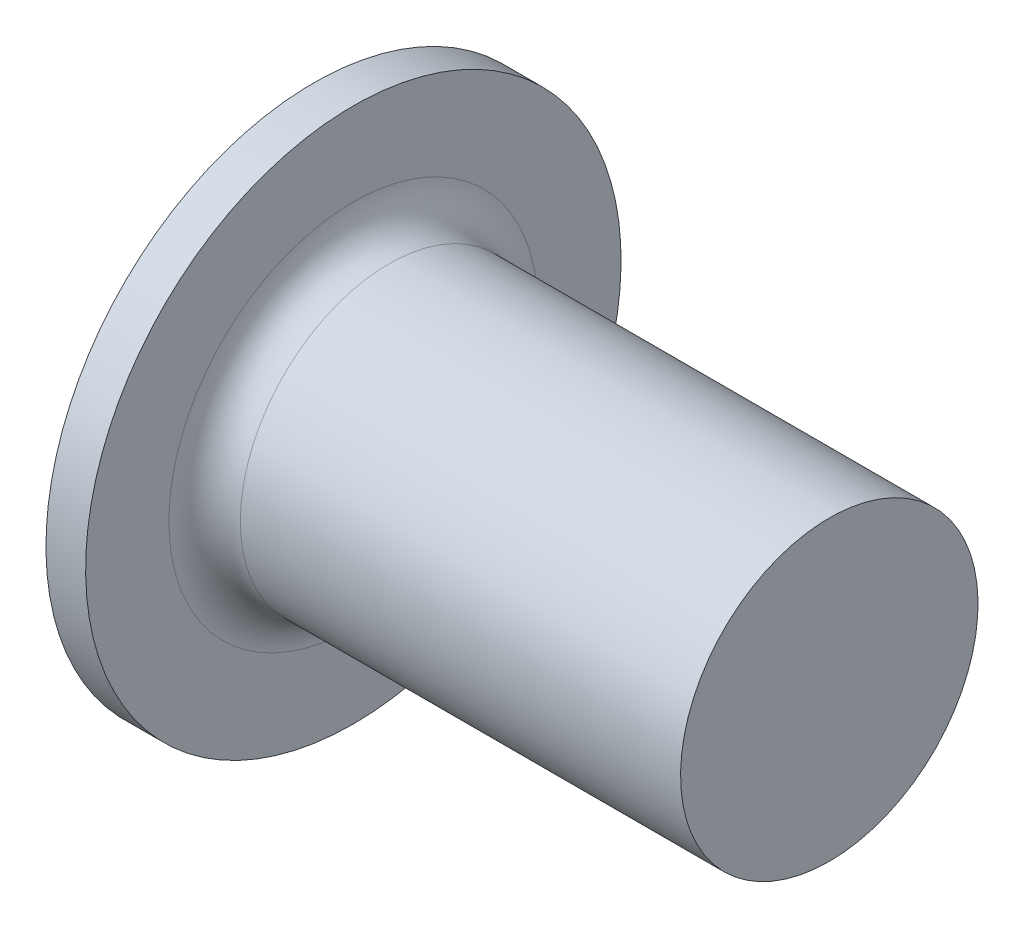
from build123d import *

# Parameters (mm, degrees)
CUT_EXTRUDE1_DEPTH = 1
FILLET1_R          = 0.6


with BuildPart() as part:
    # Sketch1 → Revolve1 (revolve)
    with BuildSketch(Plane.XY):
        Polygon((0, 2.5), (8, 2.5), (8, 0), (-1, 0), (-1, 3.922649731), (-0.666666667, 4.5), (0, 4.5), align=None)
    revolve(axis=Axis((-1, 0, 0), (1, 0, 0)))

    # Sketch2 → Cut-Extrude1 (cut)
    with BuildSketch(Plane(origin=(-1, 0, 0), x_dir=(0, 0, -1), z_dir=(1, 0, 0))):
        with BuildLine():
            ThreePointArc((0.268841336, 1.198258139), (0, 1.4), (-0.268841336, 1.198258139))
            ThreePointArc((-0.268841336, 1.198258139), (-0.5125, 0.887676039), (-0.903301321, 0.831952496))
            ThreePointArc((-0.903301321, 0.831952496), (-1.212435565, 0.7), (-1.172142656, 0.366305643))
            ThreePointArc((-1.172142656, 0.366305643), (-1.025, 0), (-1.172142656, -0.366305643))
            ThreePointArc((-1.172142656, -0.366305643), (-1.212435565, -0.7), (-0.903301321, -0.831952496))
            ThreePointArc((-0.903301321, -0.831952496), (-0.5125, -0.887676039), (-0.268841336, -1.198258139))
            ThreePointArc((-0.268841336, -1.198258139), (0, -1.4), (0.268841336, -1.198258139))
            ThreePointArc((0.268841336, -1.198258139), (0.5125, -0.887676039), (0.903301321, -0.831952496))
            ThreePointArc((0.903301321, -0.831952496), (1.212435565, -0.7), (1.172142656, -0.366305643))
            ThreePointArc((1.172142656, -0.366305643), (1.025, 0), (1.172142656, 0.366305643))
            ThreePointArc((1.172142656, 0.366305643), (1.212435565, 0.7), (0.903301321, 0.831952496))
            ThreePointArc((0.903301321, 0.831952496), (0.5125, 0.887676039), (0.268841336, 1.198258139))
        make_face()
    extrude(amount=CUT_EXTRUDE1_DEPTH, mode=Mode.SUBTRACT)

    # Fillet1
    fillet1_edges = [part.edges().sort_by_distance(p)[0] for p in [
        (0, -2.5, 0),
    ]]
    fillet(fillet1_edges, radius=FILLET1_R)


solid = part.part
